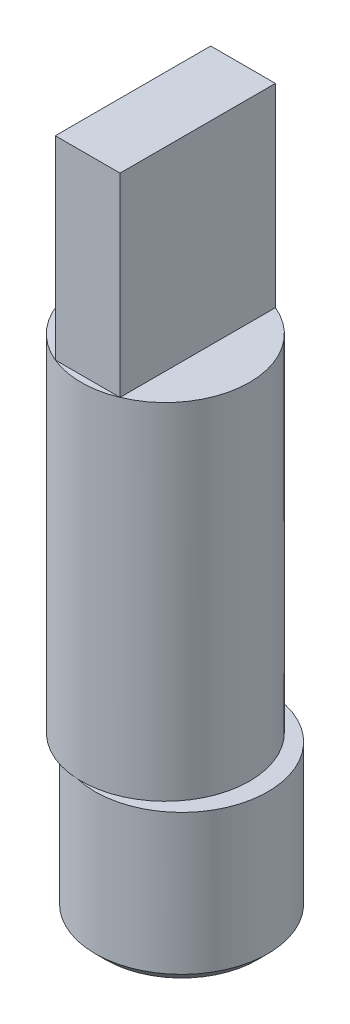
from build123d import *

# Parameters (mm, degrees)
SKETCH1_R           = 4
BOSS_EXTRUDE1_DEPTH = 7
SKETCH2_R           = 3.9
BOSS_EXTRUDE2_DEPTH = 16
CHAMFER1_SIZE       = 0.5
SKETCH3_W           = 3
SKETCH3_H           = 7.2
BOSS_EXTRUDE3_DEPTH = 9


with BuildPart() as part:
    # Sketch1 → Boss-Extrude1 (new body)
    with BuildSketch(Plane(origin=(0, 0, 0), x_dir=(1, 0, 0), z_dir=(0, 1, 0))):
        with Locations(Location((0, 0, 0), (0, 0, 270))):
            Circle(SKETCH1_R)
    extrude(amount=BOSS_EXTRUDE1_DEPTH)

    # Sketch2 → Boss-Extrude2 (add)
    with BuildSketch(Plane(origin=(0, 7, 0), x_dir=(1, 0, 0), z_dir=(0, 1, 0))):
        with Locations(Location((-0.75, 0, 0), (0, 0, 92.228731213))):
            Circle(SKETCH2_R)
    extrude(amount=BOSS_EXTRUDE2_DEPTH)

    # Chamfer1
    chamfer1_edges = [part.edges().sort_by_distance(p)[0] for p in [
        (0, 0, -4),
    ]]
    chamfer(chamfer1_edges, length=CHAMFER1_SIZE)

    # Sketch3 → Boss-Extrude3 (add)
    with BuildSketch(Plane(origin=(0, 23, 0), x_dir=(1, 0, 0), z_dir=(0, 1, 0))):
        with Locations((-0.75, 0)):
            Rectangle(SKETCH3_W, SKETCH3_H)
    extrude(amount=BOSS_EXTRUDE3_DEPTH)


solid = part.part
